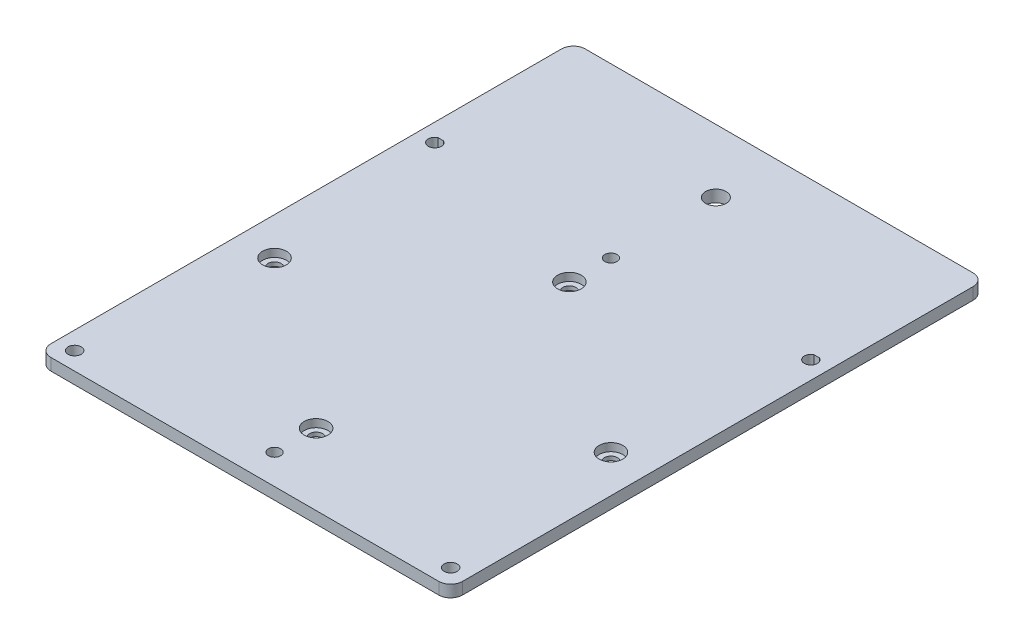
from build123d import *

# Parameters (mm, degrees)
SKETCH_1_W                   = 104
SKETCH_1_H                   = 100
EXTRUDE_1_DEPTH              = 3
HOLE_WIZARD_3_3_3_3_1_D      = 3.3
HOLE_WIZARD_M3_1_D           = 3.3
HOLE_WIZARD_M3_1_CBORE_D     = 6
HOLE_WIZARD_M3_1_CBORE_DEPTH = 2
FILLET_1_R                   = 3
SKETCH_49_R                  = 1.55
CUT_EXTRUDE_44_DEPTH         = 145.308696897
SKETCH_50_W                  = 104
SKETCH_50_H                  = 38
EXTRUDE_2_DEPTH              = 3
SKETCH_51_R                  = 2.6
CUT_EXTRUDE_45_DEPTH         = 145.308696897
FILLET_2_R                   = 3


with BuildPart() as part:
    # 草图1 → 凸台-拉伸1 (new body)
    with BuildSketch(Plane.XZ):
        with Locations((52, 50)):
            Rectangle(SKETCH_1_W, SKETCH_1_H)
    extrude(amount=-EXTRUDE_1_DEPTH)

    # Ø3.3 (3.3) 直径孔1 (through all)
    with Locations(Plane(origin=(0, 0, 0), x_dir=(-1, 0, 0), z_dir=(0, -1, 0))):
        with Locations((-4.5, -4.5), (-99.5, -4.5), (-99.5, -95.5), (-4.5, -95.5)):
            Hole(HOLE_WIZARD_3_3_3_3_1_D / 2)

    # M3 六角头机械螺钉的柱形沉头孔1 (through all)
    with Locations(Plane(origin=(0, 3, 0), x_dir=(1, 0, 0), z_dir=(0, 1, 0))):
        with Locations((52, -18), (94.5, -50), (9.5, -50), (52, -82)):
            CounterBoreHole(HOLE_WIZARD_M3_1_D / 2, HOLE_WIZARD_M3_1_CBORE_D / 2, HOLE_WIZARD_M3_1_CBORE_DEPTH)

    # 圆角1
    fillet_1_edges = [part.edges().sort_by_distance(p)[0] for p in [
        (0, 1.5, 100),
        (104, 1.5, 100),
        (104, 1.5, 0),
        (0, 1.5, 0),
    ]]
    fillet(fillet_1_edges, radius=FILLET_1_R)

    # 草图49 → 切除-拉伸44 (cut, through all)
    with BuildSketch(Plane(origin=(0, 3, 0), x_dir=(1, 0, 0), z_dir=(0, 1, 0))):
        with Locations(Location((52, -7.5, 0), (0, 0, 270))):
            Circle(SKETCH_49_R)
        with Locations(Location((52, -92.5, 0), (0, 0, 90))):
            Circle(SKETCH_49_R)
    extrude(amount=-CUT_EXTRUDE_44_DEPTH, mode=Mode.SUBTRACT)

    # 草图50 → 凸台-拉伸2 (add)
    with BuildSketch(Plane(origin=(0, 3, 0), x_dir=(1, 0, 0), z_dir=(0, 1, 0))):
        with Locations((52, 16)):
            Rectangle(SKETCH_50_W, SKETCH_50_H)
    extrude(amount=-EXTRUDE_2_DEPTH)

    # 草图51 → 切除-拉伸45 (cut, through all)
    with BuildSketch(Plane(origin=(0, 3, 0), x_dir=(1, 0, 0), z_dir=(0, 1, 0))):
        with Locations(Location((52, 19, 0), (0, 0, 270))):
            Circle(SKETCH_51_R)
    extrude(amount=-CUT_EXTRUDE_45_DEPTH, mode=Mode.SUBTRACT)

    # 圆角2
    fillet_2_edges = [part.edges().sort_by_distance(p)[0] for p in [
        (104, 1.5, -35),
        (0, 1.5, -35),
    ]]
    fillet(fillet_2_edges, radius=FILLET_2_R)


solid = part.part
